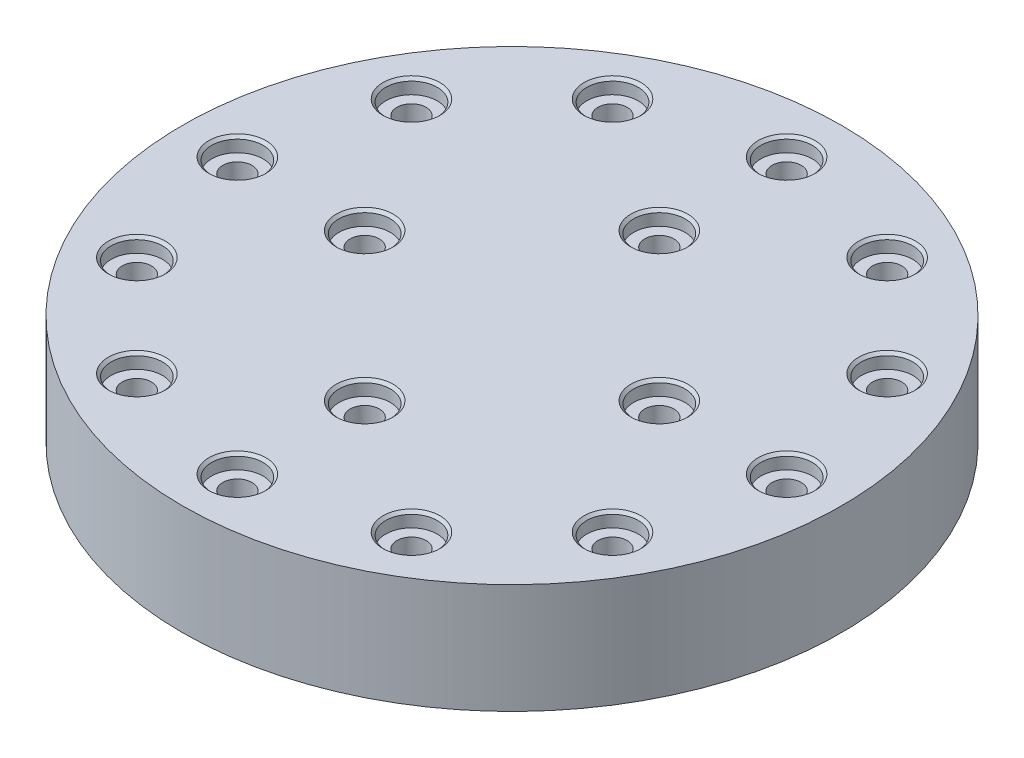
from build123d import *

# Parameters (mm, degrees)
SKETCH1_R                                     = 76.2
BOSS_EXTRUDE1_DEPTH                           = 25.4
CBORE_FOR_1_4_BUTTON_HEAD_CAP_SCREW2_AT_COUNT = 2
CBORE_FOR_1_4_BUTTON_HEAD_CAP_SCREW2_AT_PITCH = 48.170302877
CBORE_FOR_1_4_BUTTON_HEAD_CAP_SCREW2_2_COUNT  = 2
CBORE_FOR_1_4_BUTTON_HEAD_CAP_SCREW2_2_PITCH  = 68.123095633
CBORE_FOR_1_4_BUTTON_HEAD_CAP_SCREW2_3_COUNT  = 2
CBORE_FOR_1_4_BUTTON_HEAD_CAP_SCREW2_3_PITCH  = 48.170302877
CIRPATTERN1_COUNT                             = 12


with BuildPart() as part:
    # Sketch1 → Boss-Extrude1 (new body)
    with BuildSketch(Plane(origin=(0, 0, 0), x_dir=(1, 0, 0), z_dir=(0, 1, 0))):
        with Locations(Location((0, 0, 0), (0, 0, 270))):
            Circle(SKETCH1_R)
    extrude(amount=-BOSS_EXTRUDE1_DEPTH)

    # Sketch13 → CBORE for 1/4 Button Head Cap Screw2 (revolve, cut)
    with BuildSketch(Plane(origin=(-34.061547816, 0, 0), x_dir=(0, 0, 1), z_dir=(1, 0, 0))):
        Polygon((0, 0), (0, 25.4), (3.3782, 25.4), (3.3782, 3.3528), (5.95376, 3.3528), (5.95376, 0.635), (6.58876, 0), align=None)
    cbore_for_1_4_button_head_cap_screw2 = revolve(axis=Axis((-34.061547816, 6.35, 0), (0, -1, 0)), mode=Mode.SUBTRACT)

    # CBORE for 1/4 Button Head Cap Screw2 at: CBORE for 1/4 Button Head Cap Screw2 ×2
    with Locations(*[Vector(0.7071067811865476, 0, -0.7071067811865476) * (i * CBORE_FOR_1_4_BUTTON_HEAD_CAP_SCREW2_AT_PITCH) for i in range(1, CBORE_FOR_1_4_BUTTON_HEAD_CAP_SCREW2_AT_COUNT)]):
        add(cbore_for_1_4_button_head_cap_screw2, mode=Mode.SUBTRACT)

    # CBORE for 1_4 Button Head Cap Screw2 2: CBORE for 1/4 Button Head Cap Screw2 ×2
    with Locations(*[(i * CBORE_FOR_1_4_BUTTON_HEAD_CAP_SCREW2_2_PITCH, 0, 0) for i in range(1, CBORE_FOR_1_4_BUTTON_HEAD_CAP_SCREW2_2_COUNT)]):
        add(cbore_for_1_4_button_head_cap_screw2, mode=Mode.SUBTRACT)

    # CBORE for 1_4 Button Head Cap Screw2 3: CBORE for 1/4 Button Head Cap Screw2 ×2
    with Locations(*[Vector(0.7071067811865476, 0, 0.7071067811865476) * (i * CBORE_FOR_1_4_BUTTON_HEAD_CAP_SCREW2_3_PITCH) for i in range(1, CBORE_FOR_1_4_BUTTON_HEAD_CAP_SCREW2_3_COUNT)]):
        add(cbore_for_1_4_button_head_cap_screw2, mode=Mode.SUBTRACT)

    # Sketch16 → CBORE for 1/4 Button Head Cap Screw3 (revolve, cut)
    with BuildSketch(Plane(origin=(63.5, 0, 0), x_dir=(0, 0, 1), z_dir=(1, 0, 0))):
        Polygon((0, 0), (0, 25.4), (3.3782, 25.4), (3.3782, 3.3528), (5.95376, 3.3528), (5.95376, 0.635), (6.58876, 0), align=None)
    cbore_for_1_4_button_head_cap_screw3 = revolve(axis=Axis((63.5, 6.35, 0), (0, -1, 0)), mode=Mode.SUBTRACT)

    # CirPattern1: CBORE for 1/4 Button Head Cap Screw3 ×12 about axis
    cirpattern1_axis = Axis((0, 0, 0), (0, 1, 0))
    for i in range(1, CIRPATTERN1_COUNT):
        add(cbore_for_1_4_button_head_cap_screw3.rotate(cirpattern1_axis, i * 360 / CIRPATTERN1_COUNT), mode=Mode.SUBTRACT)


solid = part.part
